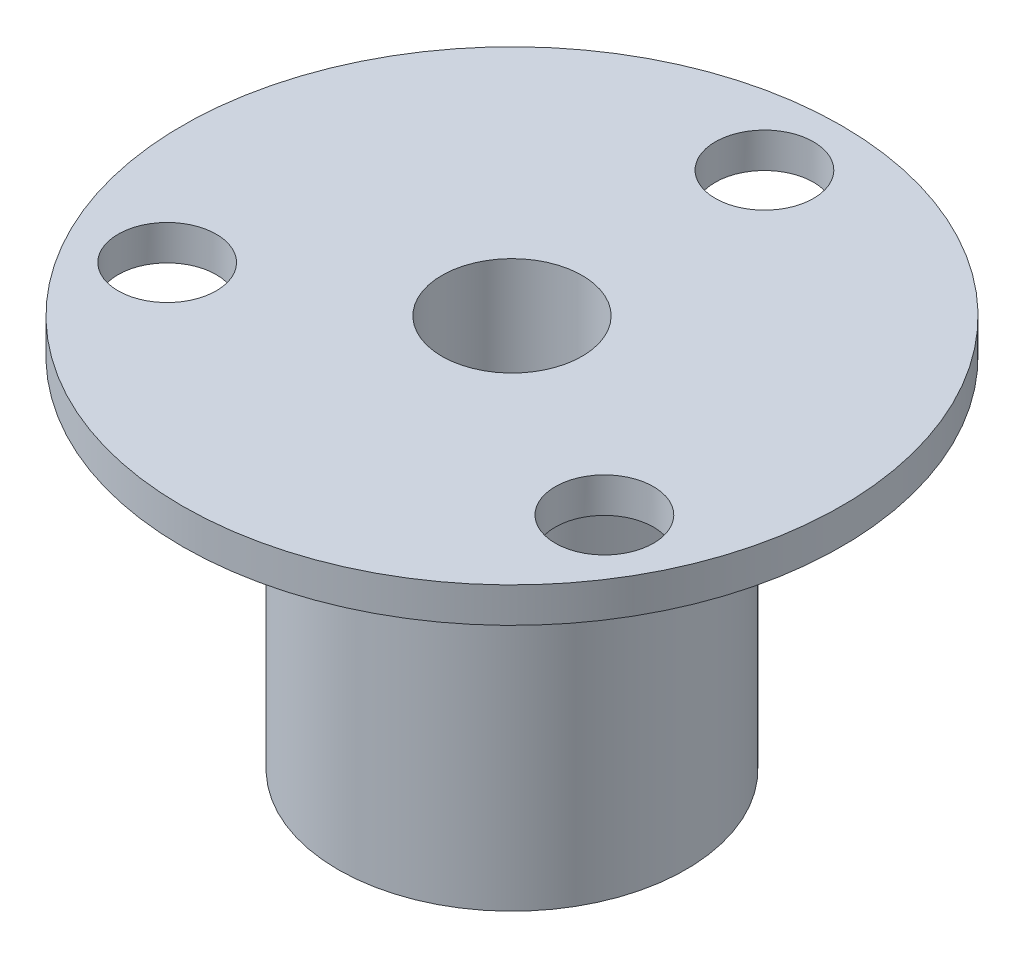
from build123d import *

# Parameters (mm, degrees)
SKETCH2_R          = 2.5
CUT_EXTRUDE1_DEPTH = 56
SKETCH3_R          = 1.75
CUT_EXTRUDE2_DEPTH = 10


with BuildPart() as part:
    # Sketch1 → Revolve1 (revolve)
    with BuildSketch(Plane.XY, mode=Mode.PRIVATE) as revolve1_sk:
        Polygon((0, 16.8), (2, 16.8), (2, 14), (11.75, 14), (11.75, 12.75), (6.2, 12.75), (6.2, 0), (0, 0), align=None)
    revolve(revolve1_sk.sketch.rotate(Axis((0, 0, 0), (0, 1, 0)), 90), axis=Axis((0, 0, 0), (0, 1, 0)))

    # Sketch2 → Cut-Extrude1 (cut)
    with BuildSketch(Plane(origin=(0, 16.8, 0), x_dir=(1, 0, 0), z_dir=(0, 1, 0))):
        with Locations(Location((0, 0, 0), (0, 0, 270))):
            Circle(SKETCH2_R)
    extrude(amount=-CUT_EXTRUDE1_DEPTH, mode=Mode.SUBTRACT)

    # Sketch3 → Cut-Extrude2 (cut)
    with BuildSketch(Plane(origin=(0, 14, 0), x_dir=(1, 0, 0), z_dir=(0, 1, 0))):
        with Locations(Location((0, 9, 0), (0, 0, 270))):
            Circle(SKETCH3_R)
        with Locations(Location((7.794228634, -4.5, 0), (0, 0, 270))):
            Circle(SKETCH3_R)
        with Locations(Location((-7.794228634, -4.5, 0), (0, 0, 270))):
            Circle(SKETCH3_R)
    extrude(amount=-CUT_EXTRUDE2_DEPTH, mode=Mode.SUBTRACT)


solid = part.part
